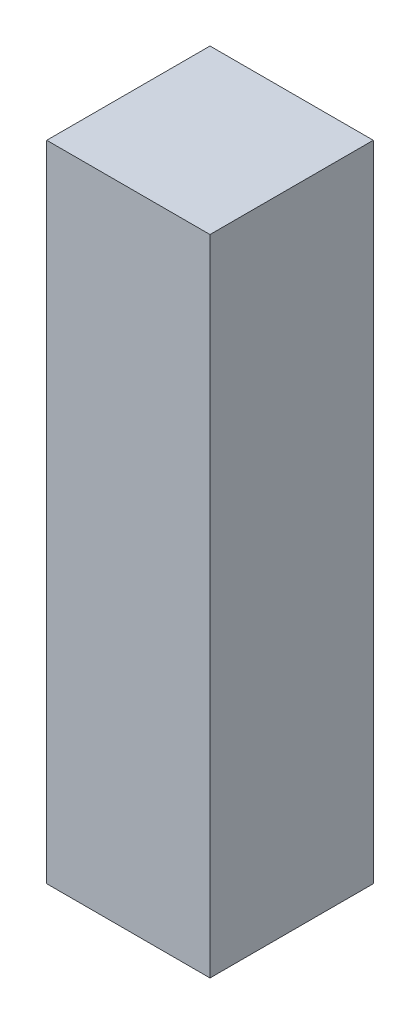
from build123d import *

# Parameters (mm, degrees)
SKETCH1_W           = 16000
SKETCH1_H           = 16000
BOSS_EXTRUDE1_DEPTH = 63100


with BuildPart() as part:
    # Sketch1 → Boss-Extrude1 (new body)
    with BuildSketch(Plane(origin=(0, 0, 0), x_dir=(1, 0, 0), z_dir=(0, 1, 0))):
        with Locations((0, 523.465978631)):
            Rectangle(SKETCH1_W, SKETCH1_H)
    extrude(amount=BOSS_EXTRUDE1_DEPTH)


solid = part.part
